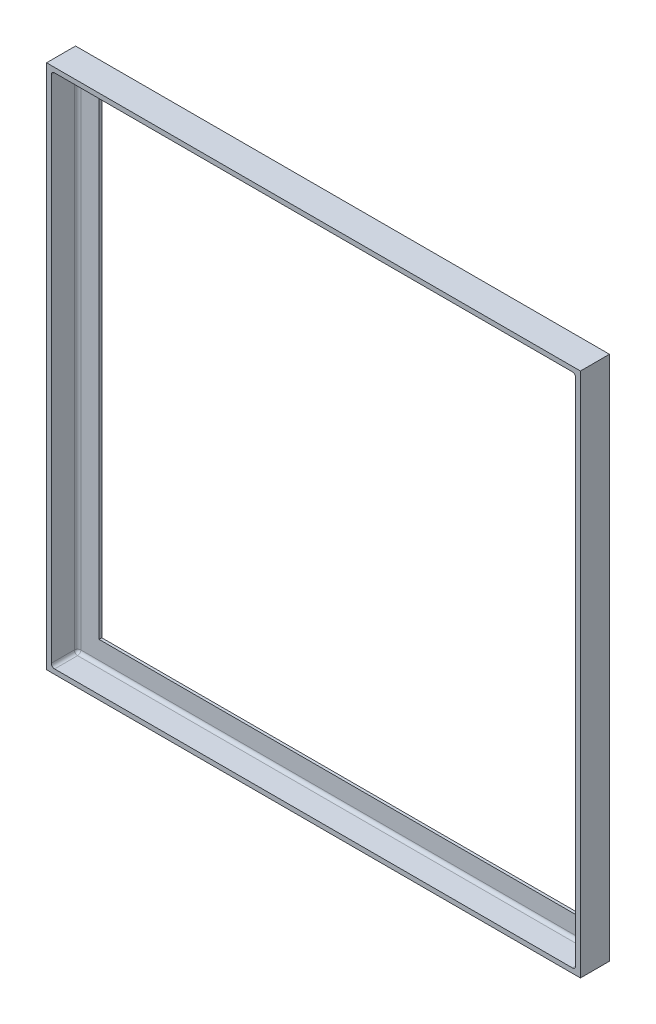
from build123d import *

# Parameters (mm, degrees)
SKETCH1_W        = 515.9375
SKETCH1_H        = 508
SKETCH1_W_2      = 465.1375
SKETCH1_H_2      = 457.2
EXTRUSION1_DEPTH = 2.65684
SKETCH2_W        = 515.9375
SKETCH2_H        = 508
SKETCH2_W_2      = 506.766296236
SKETCH2_H_2      = 498.828796236
EXTRUSION2_DEPTH = 25.4
FILLET1_R        = 3.175


with BuildPart() as part:
    # Sketch1 → Extrusion1 (new body)
    with BuildSketch(Plane.XY):
        Rectangle(SKETCH1_W, SKETCH1_H)
        Rectangle(SKETCH1_W_2, SKETCH1_H_2, mode=Mode.SUBTRACT)
    extrude(amount=EXTRUSION1_DEPTH)

    # Sketch2 → Extrusion2 (add)
    with BuildSketch(Plane.XY.offset(2.65684)):
        Rectangle(SKETCH2_W, SKETCH2_H)
        Rectangle(SKETCH2_W_2, SKETCH2_H_2, mode=Mode.SUBTRACT)
    extrude(amount=EXTRUSION2_DEPTH)

    # Fillet1
    fillet1_edges = [part.edges().sort_by_distance(p)[0] for p in [
        (-253.383148118, -249.414398118, 15.35684),
        (-253.383148118, 249.414398118, 15.35684),
        (253.383148118, 249.414398118, 15.35684),
        (253.383148118, -249.414398118, 15.35684),
        (-253.383148118, 0, 2.65684),
        (0, -249.414398118, 2.65684),
        (253.383148118, 0, 2.65684),
        (0, 249.414398118, 2.65684),
    ]]
    fillet(fillet1_edges, radius=FILLET1_R)


solid = part.part
